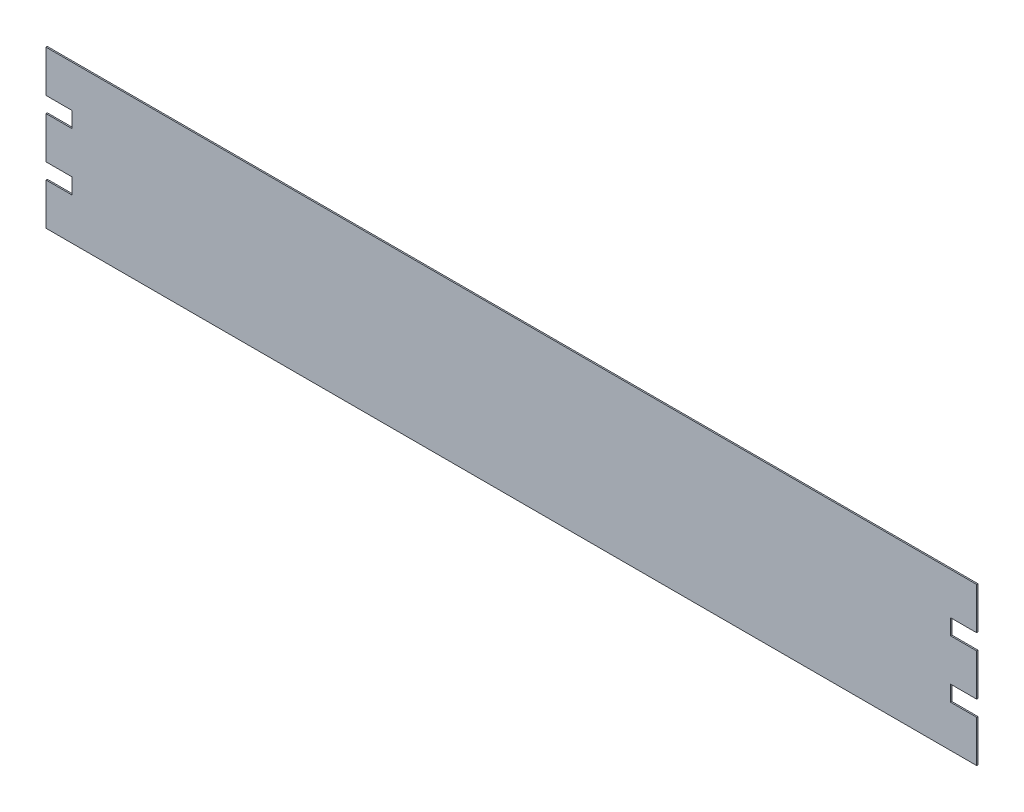
from build123d import *

# Parameters (mm, degrees)
BOSS_EXTRUDE1_DEPTH  = 0.125
SKETCH4_W            = 5
SKETCH4_H            = 3
CUT_EXTRUDE2_DEPTH   = 185.889325003
LPATTERN3_COUNT      = 4
LPATTERN3_PITCH      = 11
LPATTERN3_COUNT_DIR2 = 2
LPATTERN3_PITCH_DIR2 = 173
SKETCH5_W            = 178
SKETCH5_H            = 20
CUT_EXTRUDE3_DEPTH   = 185.889325003


with BuildPart() as part:
    # Sketch2 → Boss-Extrude1 (new, symmetric)
    with BuildSketch(Plane.XY):
        Polygon((0, 0), (5, 0), (173, 20), (178, 20), (178, 50), (0, 50), align=None)
    extrude(amount=BOSS_EXTRUDE1_DEPTH, both=True)

    # Sketch4 → Cut-Extrude2 (cut, through all)
    with BuildSketch(Plane.XY.offset(0.125)):
        with Locations((175.5, 40.5)):
            Rectangle(SKETCH4_W, SKETCH4_H)
    cut_extrude2 = extrude(amount=-CUT_EXTRUDE2_DEPTH, mode=Mode.SUBTRACT)

    # LPattern3: Cut-Extrude2 4 × 2
    with Locations(*[(-j * LPATTERN3_PITCH_DIR2, -i * LPATTERN3_PITCH, 0) for i in range(LPATTERN3_COUNT) for j in range(LPATTERN3_COUNT_DIR2) if (i, j) != (0, 0)]):
        add(cut_extrude2, mode=Mode.SUBTRACT)

    # Sketch5 → Cut-Extrude3 (cut, through all)
    with BuildSketch(Plane.XY.offset(0.125)):
        with Locations((89, 10)):
            Rectangle(SKETCH5_W, SKETCH5_H)
    extrude(amount=-CUT_EXTRUDE3_DEPTH, mode=Mode.SUBTRACT)


solid = part.part
